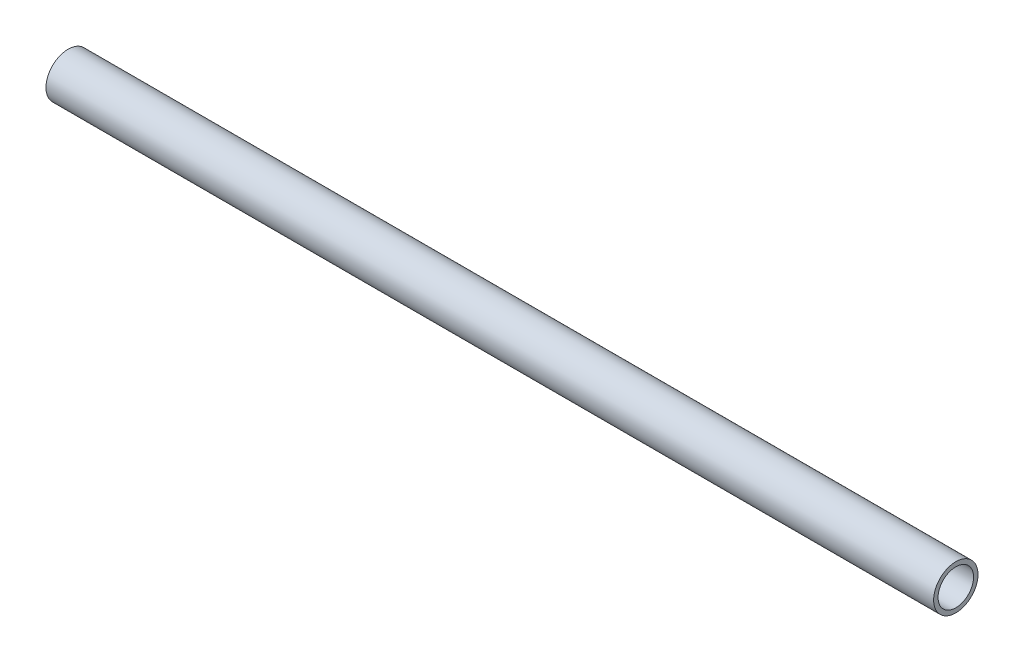
from build123d import *

# Parameters (mm, degrees)
SKETCH_1_R      = 5
SKETCH_1_R_2    = 4
EXTRUDE_1_DEPTH = 100


with BuildPart() as part:
    # 草图1 → 凸台-拉伸1 (new, symmetric)
    with BuildSketch(Plane(origin=(0, 0, 0), x_dir=(0, 0, -1), z_dir=(1, 0, 0))):
        Circle(SKETCH_1_R)
        Circle(SKETCH_1_R_2, mode=Mode.SUBTRACT)
    extrude(amount=EXTRUDE_1_DEPTH, both=True)


solid = part.part
